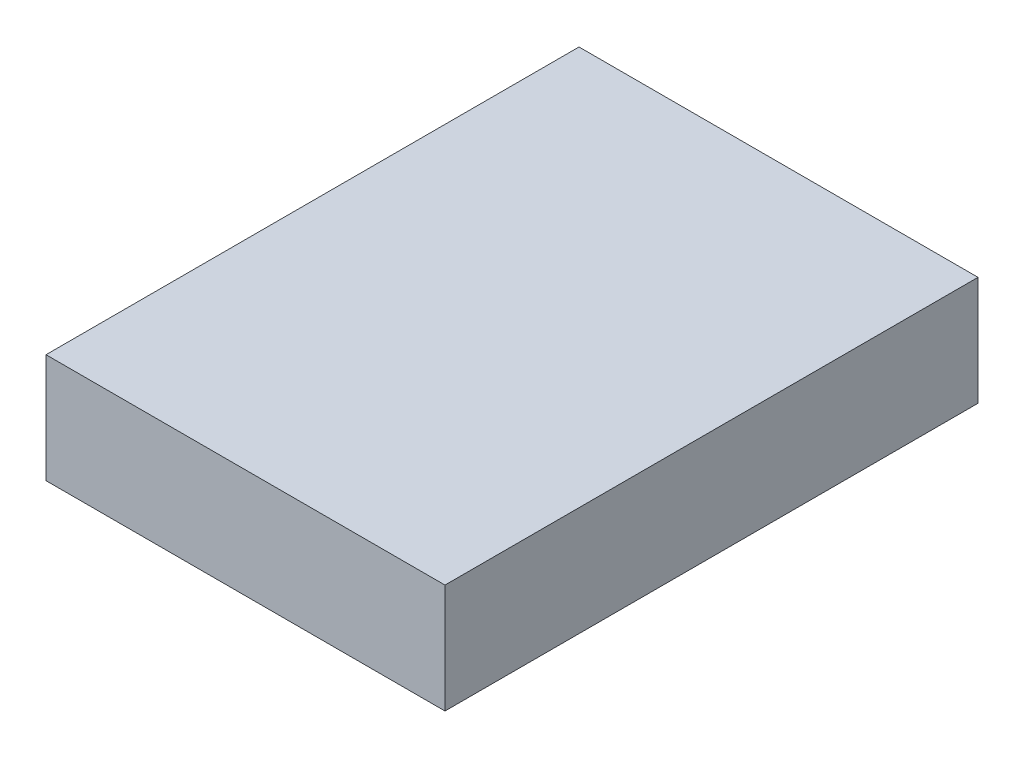
from build123d import *

# Parameters (mm, degrees)
CROQUIS1_W              = 25.6
CROQUIS1_H              = 34.2
SALIENTE_EXTRUIR1_DEPTH = 7


with BuildPart() as part:
    # Croquis1 → Saliente-Extruir1 (new body)
    with BuildSketch(Plane(origin=(0, 0, 0), x_dir=(1, 0, 0), z_dir=(0, 1, 0))):
        Rectangle(CROQUIS1_W, CROQUIS1_H)
    extrude(amount=SALIENTE_EXTRUIR1_DEPTH)


solid = part.part
